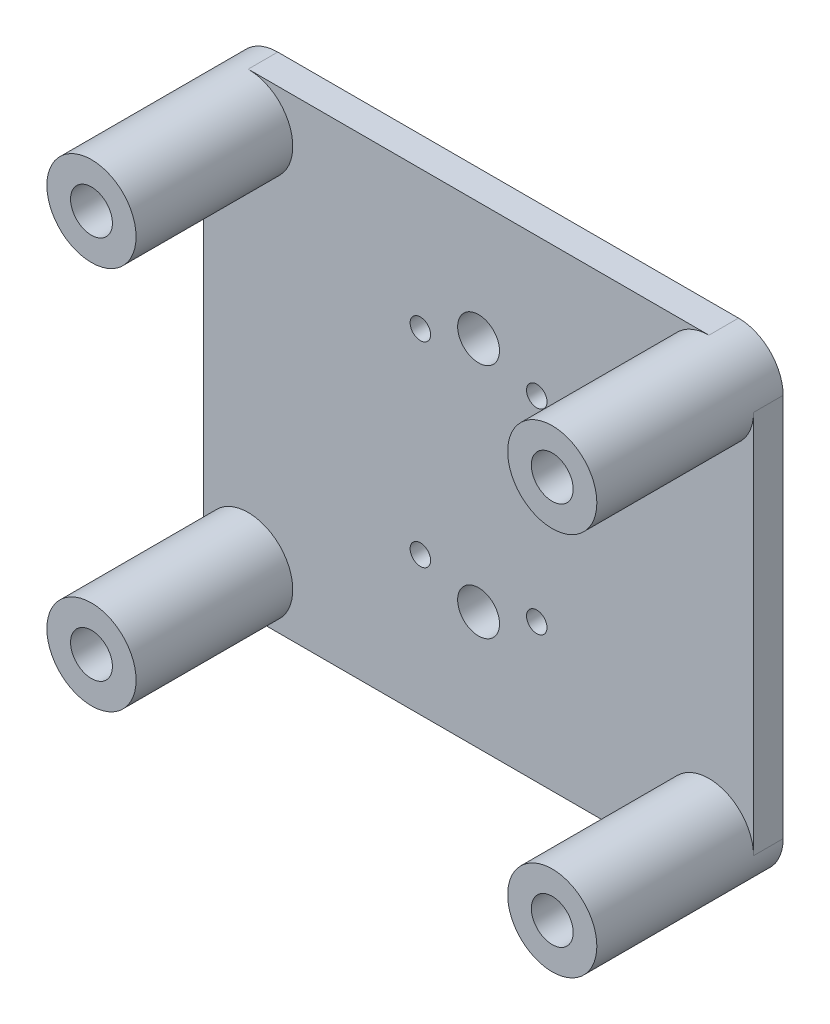
from build123d import *

# Parameters (mm, degrees)
SKETCH1_R           = 2.2479
SKETCH1_R_2         = 1.1
BOSS_EXTRUDE1_DEPTH = 3.175
BOSS_EXTRUDE2_START = -5.08
SKETCH1_4_R         = 2.2
SKETCH1_4_R_2       = 1.1
BOSS_EXTRUDE2_DEPTH = 5.08
SKETCH1_5_R         = 4.7879
SKETCH1_5_R_2       = 2.2479
BOSS_EXTRUDE3_DEPTH = 20.0025


with BuildPart() as part:
    # Sketch1 → Boss-Extrude1 (new body)
    with BuildSketch(Plane.XY):
        with BuildLine():
            Line((-16.612553398, 47.733487864), (-16.612553398, 6.509287864))
            ThreePointArc((-16.612553398, 6.509287864), (-15.210209956, 3.123731306), (-11.824653398, 1.721387864))
            Line((-11.824653398, 1.721387864), (37.654546627, 1.721387864))
            ThreePointArc((37.654546627, 1.721387864), (41.040103169, 3.123731315), (42.442446602, 6.509287864))
            Line((42.442446602, 6.509287864), (42.442446602, 47.733487864))
            ThreePointArc((42.442446602, 47.733487864), (41.04010316, 51.119044422), (37.654546602, 52.521387864))
            Line((37.654546602, 52.521387864), (-11.824653398, 52.521387864))
            ThreePointArc((-11.824653398, 52.521387864), (-15.210209956, 51.119044422), (-16.612553398, 47.733487864))
        make_face()
        with Locations((12.914946602, 14.421387864)):
            Circle(SKETCH1_R, mode=Mode.SUBTRACT)
        with Locations((12.914946602, 39.821387864)):
            Circle(SKETCH1_R, mode=Mode.SUBTRACT)
        with Locations((-11.824653398, 6.509287864)):
            Circle(SKETCH1_R, mode=Mode.SUBTRACT)
        with Locations((-11.824653398, 47.733487864)):
            Circle(SKETCH1_R, mode=Mode.SUBTRACT)
        with Locations((37.654546602, 47.733487864)):
            Circle(SKETCH1_R, mode=Mode.SUBTRACT)
        with Locations((37.654546602, 6.509287864)):
            Circle(SKETCH1_R, mode=Mode.SUBTRACT)
        with Locations((6.664946602, 16.621387864)):
            Circle(SKETCH1_R_2, mode=Mode.SUBTRACT)
        with Locations((19.164946602, 16.621387864)):
            Circle(SKETCH1_R_2, mode=Mode.SUBTRACT)
        with Locations((6.664946602, 37.621387864)):
            Circle(SKETCH1_R_2, mode=Mode.SUBTRACT)
        with Locations((19.164946602, 37.621387864)):
            Circle(SKETCH1_R_2, mode=Mode.SUBTRACT)
    extrude(amount=BOSS_EXTRUDE1_DEPTH)

    # Sketch1<4> → Boss-Extrude2 (add)
    # profile 1 of 4: a face of its own
    with BuildSketch(Plane.XY.offset(BOSS_EXTRUDE2_START)):
        with Locations((19.164946602, 16.621387864)):
            Circle(SKETCH1_4_R)
        with Locations((19.164946602, 16.621387864)):
            Circle(SKETCH1_4_R_2, mode=Mode.SUBTRACT)
    # profile 2 of 4: a face of its own
    with BuildSketch(Plane.XY.offset(BOSS_EXTRUDE2_START)):
        with Locations((6.664946602, 16.621387864)):
            Circle(SKETCH1_4_R)
        with Locations((6.664946602, 16.621387864)):
            Circle(SKETCH1_4_R_2, mode=Mode.SUBTRACT)
    # profile 3 of 4: a face of its own
    with BuildSketch(Plane.XY.offset(BOSS_EXTRUDE2_START)):
        with Locations((6.664946602, 37.621387864)):
            Circle(SKETCH1_4_R)
        with Locations((6.664946602, 37.621387864)):
            Circle(SKETCH1_4_R_2, mode=Mode.SUBTRACT)
    # profile 4 of 4: a face of its own
    with BuildSketch(Plane.XY.offset(BOSS_EXTRUDE2_START)):
        with Locations((19.164946602, 37.621387864)):
            Circle(SKETCH1_4_R)
        with Locations((19.164946602, 37.621387864)):
            Circle(SKETCH1_4_R_2, mode=Mode.SUBTRACT)
    extrude(amount=BOSS_EXTRUDE2_DEPTH)

    # Sketch1<5> → Boss-Extrude3 (add)
    # profile 1 of 4: a face of its own
    with BuildSketch(Plane.XY):
        with Locations((-11.824653398, 6.509287864)):
            Circle(SKETCH1_5_R)
        with Locations((-11.824653398, 6.509287864)):
            Circle(SKETCH1_5_R_2, mode=Mode.SUBTRACT)
    # profile 2 of 4: a face of its own
    with BuildSketch(Plane.XY):
        with Locations((37.654546602, 6.509287864)):
            Circle(SKETCH1_5_R)
        with Locations((37.654546602, 6.509287864)):
            Circle(SKETCH1_5_R_2, mode=Mode.SUBTRACT)
    # profile 3 of 4: a face of its own
    with BuildSketch(Plane.XY):
        with Locations((-11.824653398, 47.733487864)):
            Circle(SKETCH1_5_R)
        with Locations((-11.824653398, 47.733487864)):
            Circle(SKETCH1_5_R_2, mode=Mode.SUBTRACT)
    # profile 4 of 4: a face of its own
    with BuildSketch(Plane.XY):
        with Locations((37.654546602, 47.733487864)):
            Circle(SKETCH1_5_R)
        with Locations((37.654546602, 47.733487864)):
            Circle(SKETCH1_5_R_2, mode=Mode.SUBTRACT)
    extrude(amount=BOSS_EXTRUDE3_DEPTH)


solid = part.part
